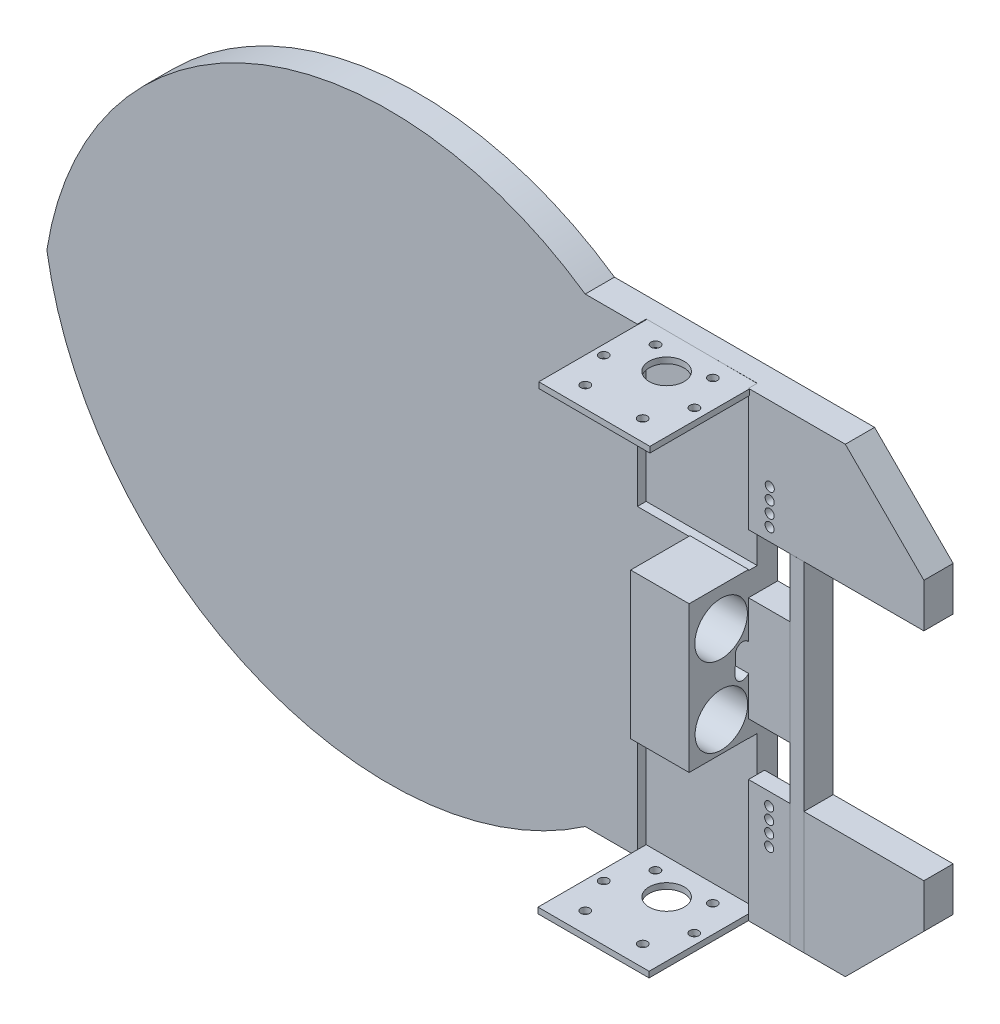
from build123d import *

# Parameters (mm, degrees)
BOSS_EXTRUDE1_DEPTH      = 10
BOSS_EXTRUDE1_DEPTH_BACK = 0.01
SKETCH3_W                = 38
SKETCH3_H                = 54
CUT_EXTRUDE1_DEPTH       = 3
SKETCH5_W                = 38
SKETCH5_H                = 54
CUT_EXTRUDE3_DEPTH       = 3
SKETCH15_W               = 20
SKETCH15_H               = 50
BOSS_EXTRUDE3_DEPTH      = 20.3
SKETCH21_R               = 9
CUT_EXTRUDE21_DEPTH      = 20
SKETCH28_W               = 4.75290021
SKETCH28_H               = 9.947843747
BOSS_EXTRUDE6_DEPTH      = 115.870057685
SKETCH30_W               = 14.12
SKETCH30_H               = 25
CUT_EXTRUDE25_DEPTH      = 4.5
SKETCH33_R               = 1.55
CUT_EXTRUDE26_DEPTH      = 10.01
SKETCH36_W               = 38
SKETCH36_H               = 2
BOSS_EXTRUDE7_DEPTH      = 37
SKETCH39_R               = 6
SKETCH39_R_2             = 1.55
CUT_EXTRUDE28_DEPTH      = 2
SKETCH42_R               = 6
SKETCH42_R_2             = 1.55
CUT_EXTRUDE29_DEPTH      = 2
BOSS_EXTRUDE8_REACH      = 265.623
SKETCH44_W               = 25.175895627
SKETCH44_H               = 35.827236085


with BuildPart() as part:
    # Sketch1 → Boss-Extrude1 (new, two sides: drawn at the far end of the back side and taken through both)
    with BuildSketch(Plane.XY.offset(-BOSS_EXTRUDE1_DEPTH_BACK)):
        with BuildLine():
            Line((0, 0), (0, -37))
            Line((0, -37), (60, -37))
            Line((60, -37), (60, -52))
            Line((60, -52), (33.129942315, -78.870057685))
            Line((33.129942315, -78.870057685), (-55.850057685, -78.870057685))
            ThreePointArc((-55.850057685, -78.870057685), (-169.614041234, -90.257166815), (-239.999947532, -0.158696229))
            ThreePointArc((-239.999947532, -0.158696229), (-169.748285548, 90.207490359), (-55.850057685, 78.870057685))
            Line((-55.850057685, 78.870057685), (33.129942315, 78.870057685))
            Line((33.129942315, 78.870057685), (60, 52))
            Line((60, 52), (60, 37))
            Line((60, 37), (0, 37))
            Line((0, 37), (0, 0))
        make_face()
    extrude(amount=BOSS_EXTRUDE1_DEPTH + BOSS_EXTRUDE1_DEPTH_BACK)

    # Sketch3 → Cut-Extrude1 (cut)
    with BuildSketch(Plane.XY.offset(10)):
        with Locations((-19, 51.870057685)):
            Rectangle(SKETCH3_W, SKETCH3_H)
    extrude(amount=-CUT_EXTRUDE1_DEPTH, mode=Mode.SUBTRACT)

    # Sketch5 → Cut-Extrude3 (cut)
    with BuildSketch(Plane.XY.offset(10)):
        with Locations((-19, -51.870057685)):
            Rectangle(SKETCH5_W, SKETCH5_H)
    extrude(amount=-CUT_EXTRUDE3_DEPTH, mode=Mode.SUBTRACT)

    # Sketch15 → Boss-Extrude3 (add)
    with BuildSketch(Plane.XY.offset(10)):
        with Locations((-10, 0.20156489)):
            Rectangle(SKETCH15_W, SKETCH15_H)
    extrude(amount=BOSS_EXTRUDE3_DEPTH)

    # Sketch21 → Cut-Extrude21 (cut)
    with BuildSketch(Plane(origin=(0, 0, 0), x_dir=(0, 0, -1), z_dir=(1, 0, 0))):
        with Locations((-19.36187505, 12.37175029)):
            Circle(SKETCH21_R)
        with Locations((-19.26539558, -14.62824971)):
            Circle(SKETCH21_R)
        with BuildLine():
            Line((-9.491579533, 2.276446619), (-9.557448357, -4.178698144))
            ThreePointArc((-9.557448357, -4.178698144), (-12.081396215, -6.651657156), (-14.554355227, -4.127709299))
            Line((-14.554355227, -4.127709299), (-14.488486403, 2.327435464))
            ThreePointArc((-14.488486403, 2.327435464), (-11.964538545, 4.800394476), (-9.491579533, 2.276446619))
        make_face()
    extrude(amount=-CUT_EXTRUDE21_DEPTH, mode=Mode.SUBTRACT)

    # Sketch28 → Boss-Extrude6 (add)
    with BuildSketch(Plane.XZ.offset(78.870057685)):
        with Locations((16.603067585, 5.033719824)):
            Rectangle(SKETCH28_W, SKETCH28_H)
    extrude(amount=-BOSS_EXTRUDE6_DEPTH)

    # Sketch30 → Cut-Extrude25 (cut)
    with BuildSketch(Plane(origin=(0, 0, -0.01), x_dir=(-1, 0, 0), z_dir=(0, 0, -1))):
        with Locations((-7.06, -49.5)):
            Rectangle(SKETCH30_W, SKETCH30_H)
        Polygon((-14.38072485, 61.935396467), (-14.275539526, 36.935617747), (-0.155664505, 36.995026418), (-0.260849829, 61.994805138), align=None)
    extrude(amount=-CUT_EXTRUDE25_DEPTH, mode=Mode.SUBTRACT)

    # Sketch33 → Cut-Extrude26 (cut)
    with BuildSketch(Plane(origin=(0, 0, -0.01), x_dir=(-1, 0, 0), z_dir=(0, 0, -1))):
        with Locations((-7.06, -53.4)):
            Circle(SKETCH33_R)
        with Locations((-7.06, -49.4)):
            Circle(SKETCH33_R)
        with Locations((-7.06, -45.4)):
            Circle(SKETCH33_R)
        with Locations((-7.06, -41.4)):
            Circle(SKETCH33_R)
        with Locations((-7.228632788, 41.370889137)):
            Circle(SKETCH33_R)
        with Locations((-7.244931474, 45.370855931)):
            Circle(SKETCH33_R)
        with Locations((-7.261230159, 49.370822725)):
            Circle(SKETCH33_R)
        with Locations((-7.277528845, 53.370789519)):
            Circle(SKETCH33_R)
    extrude(amount=-CUT_EXTRUDE26_DEPTH, mode=Mode.SUBTRACT)

    # Sketch36 → Boss-Extrude7 (add)
    with BuildSketch(Plane.XY.offset(7)):
        Polygon((0.279518574, 78.814629504), (0.272425555, 76.814642082), (-37.727335467, 76.949409435), (-37.720242449, 78.949396858), align=None)
        with Locations((-19, -77.815125164)):
            Rectangle(SKETCH36_W, SKETCH36_H)
    extrude(amount=BOSS_EXTRUDE7_DEPTH)

    # Sketch39 → Cut-Extrude28 (cut)
    with BuildSketch(Plane.XZ.offset(78.815125164)):
        with Locations(Location((-19, 19, 0), (0, 0, 270))):
            Circle(SKETCH39_R)
        with Locations(Location((-34.499611559, 25.01055106, 0), (0, 0, 270))):
            Circle(SKETCH39_R_2)
        with Locations(Location((-3.563871147, 24.988758691, 0), (0, 0, 270))):
            Circle(SKETCH39_R_2)
        with Locations(Location((-28.819186805, 37.01055106, 0), (0, 0, 270))):
            Circle(SKETCH39_R_2)
        with Locations(Location((-9.177448314, 36.988758691, 0), (0, 0, 270))):
            Circle(SKETCH39_R_2)
        with Locations(Location((-28.819994175, 13.01055106, 0), (0, 0, 270))):
            Circle(SKETCH39_R_2)
        with Locations(Location((-9.230494356, 12.988758691, 0), (0, 0, 270))):
            Circle(SKETCH39_R_2)
    extrude(amount=-CUT_EXTRUDE28_DEPTH, mode=Mode.SUBTRACT)

    # Sketch42 → Cut-Extrude29 (cut)
    with BuildSketch(Plane(origin=(0.279518574, 78.814629504, 0), x_dir=(0.9999937111161443, -0.003546509292438372, 0), z_dir=(0.003546509292438372, 0.9999937111161443, 0))):
        with Locations(Location((-19.279713392, -19, 0), (0, 0, 180))):
            Circle(SKETCH42_R)
        with Locations(Location((-29.070149337, -13, 0), (0, 0, 180))):
            Circle(SKETCH42_R_2)
        with Locations(Location((-3.778432466, -25, 0), (0, 0, 180))):
            Circle(SKETCH42_R_2)
        with Locations(Location((-9.464104196, -13, 0), (0, 0, 180))):
            Circle(SKETCH42_R_2)
        with Locations(Location((-34.772326096, -25, 0), (0, 0, 180))):
            Circle(SKETCH42_R_2)
        with Locations(Location((-29.096493177, -37, 0), (0, 0, 180))):
            Circle(SKETCH42_R_2)
        with Locations(Location((-9.473371075, -37, 0), (0, 0, 180))):
            Circle(SKETCH42_R_2)
    extrude(amount=-CUT_EXTRUDE29_DEPTH, mode=Mode.SUBTRACT)

    # Boss-Extrude8: up to this face of the body (flat: up to its plane)
    boss_extrude8_end = Plane(part.part.faces().sort_by_distance((26.749098796, 56.040998738, 10))[0])
    # Sketch44 → Boss-Extrude8 (add, up to the picked face)
    with BuildSketch(Plane(origin=(0, 0, -0.01), x_dir=(-1, 0, 0), z_dir=(0, 0, -1)), mode=Mode.PRIVATE) as boss_extrude8_sk1:
        with Locations((-4.733214954, -1.084100606)):
            Rectangle(SKETCH44_W, SKETCH44_H)
    boss_extrude8_tool1 = split(extrude(boss_extrude8_sk1.sketch, amount=-BOSS_EXTRUDE8_REACH, mode=Mode.PRIVATE), bisect_by=boss_extrude8_end, keep=Keep.BOTH, mode=Mode.PRIVATE)
    add(boss_extrude8_tool1.solids().sort_by(Axis((4.733215, -1.084101, -0.01), (0, 0, 1)))[0])


solid = part.part
